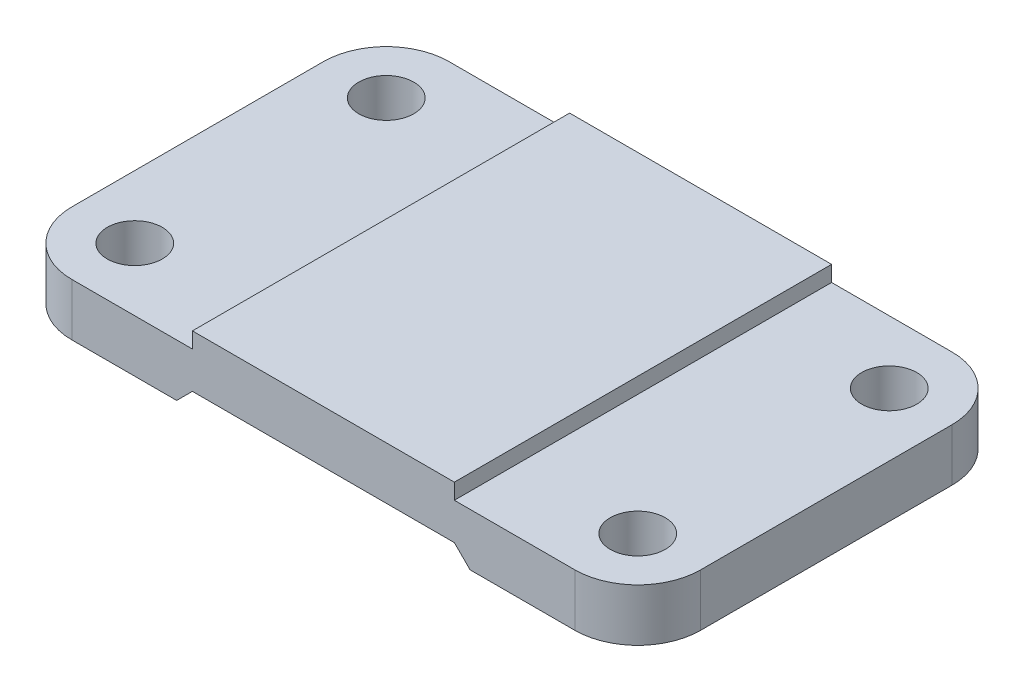
from build123d import *

# Parameters (mm, degrees)
BOSS_EXTRUDE1_DEPTH      = 36
BOSS_EXTRUDE1_DEPTH_BACK = 36
FILLET1_R                = 12
M12X1_5_TAPPED_HOLE1_D   = 10.5


with BuildPart() as part:
    # Sketch1 → Boss-Extrude1 (new, two sides: drawn at the far end of the back side and taken through both)
    with BuildSketch(Plane.XY.offset(-BOSS_EXTRUDE1_DEPTH_BACK)):
        Polygon((-25, 8), (-25, 5), (-60, 5), (-60, -5), (-28, -5), (-25, -2), (25, -2), (28, -5), (60, -5), (60, 5), (25, 5), (25, 8), align=None)
    extrude(amount=BOSS_EXTRUDE1_DEPTH + BOSS_EXTRUDE1_DEPTH_BACK)

    # Fillet1
    fillet1_edges = [part.edges().sort_by_distance(p)[0] for p in [
        (-60, 0, -36),
        (-60, 0, 36),
        (60, 0, -36),
        (60, 0, 36),
    ]]
    fillet(fillet1_edges, radius=FILLET1_R)

    # M12x1.5 Tapped Hole1 (through all)
    with Locations(Plane(origin=(0, 5, 0), x_dir=(1, 0, 0), z_dir=(0, 1, 0))):
        with Locations((-48, -24), (-48, 24), (48, 24), (48, -24)):
            Hole(M12X1_5_TAPPED_HOLE1_D / 2)


solid = part.part
